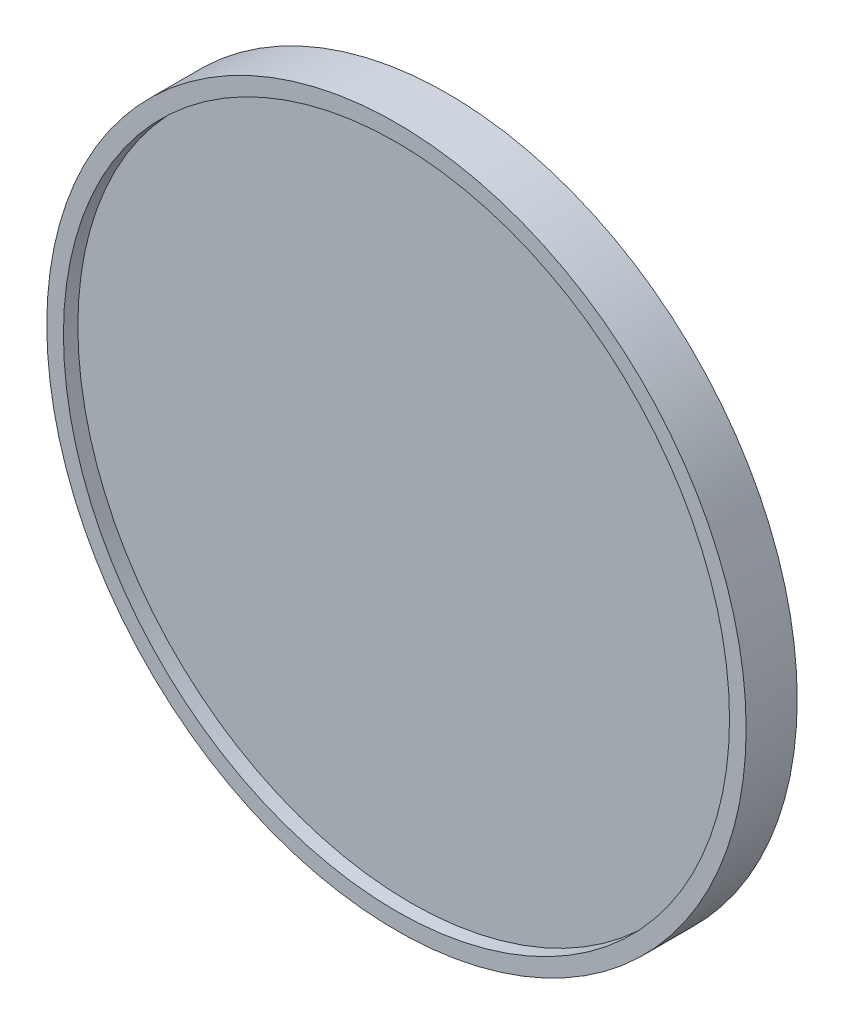
from build123d import *

# Parameters (mm, degrees)
SKETCH_1_R      = 31.5
EXTRUDE_1_DEPTH = 2
SKETCH_2_R      = 31.5
SKETCH_2_R_2    = 30
EXTRUDE_2_DEPTH = 1.3
EXTRUDE_START   = 1.3
SKETCH_3_R      = 31.5
SKETCH_3_R_2    = 30
EXTRUDE_3_DEPTH = 1.3


with BuildPart() as part:
    # 스케치1 → 보스-돌출1 (new body)
    with BuildSketch(Plane.XY):
        Circle(SKETCH_1_R)
    extrude(amount=EXTRUDE_1_DEPTH)

    # 스케치2 → 보스-돌출2 (add)
    with BuildSketch(Plane.XY.offset(2)):
        Circle(SKETCH_2_R)
        Circle(SKETCH_2_R_2, mode=Mode.SUBTRACT)
    extrude(amount=EXTRUDE_2_DEPTH)

    # 스케치3 → 보스-돌출3 (add)
    with BuildSketch(Plane(origin=(0, 0, 0), x_dir=(-1, 0, 0), z_dir=(0, 0, -1)).offset(EXTRUDE_START)):
        Circle(SKETCH_3_R)
        with Locations(Location((0, 0, 0), (0, 0, 180))):
            Circle(SKETCH_3_R_2, mode=Mode.SUBTRACT)
    extrude(amount=-EXTRUDE_3_DEPTH)


solid = part.part
